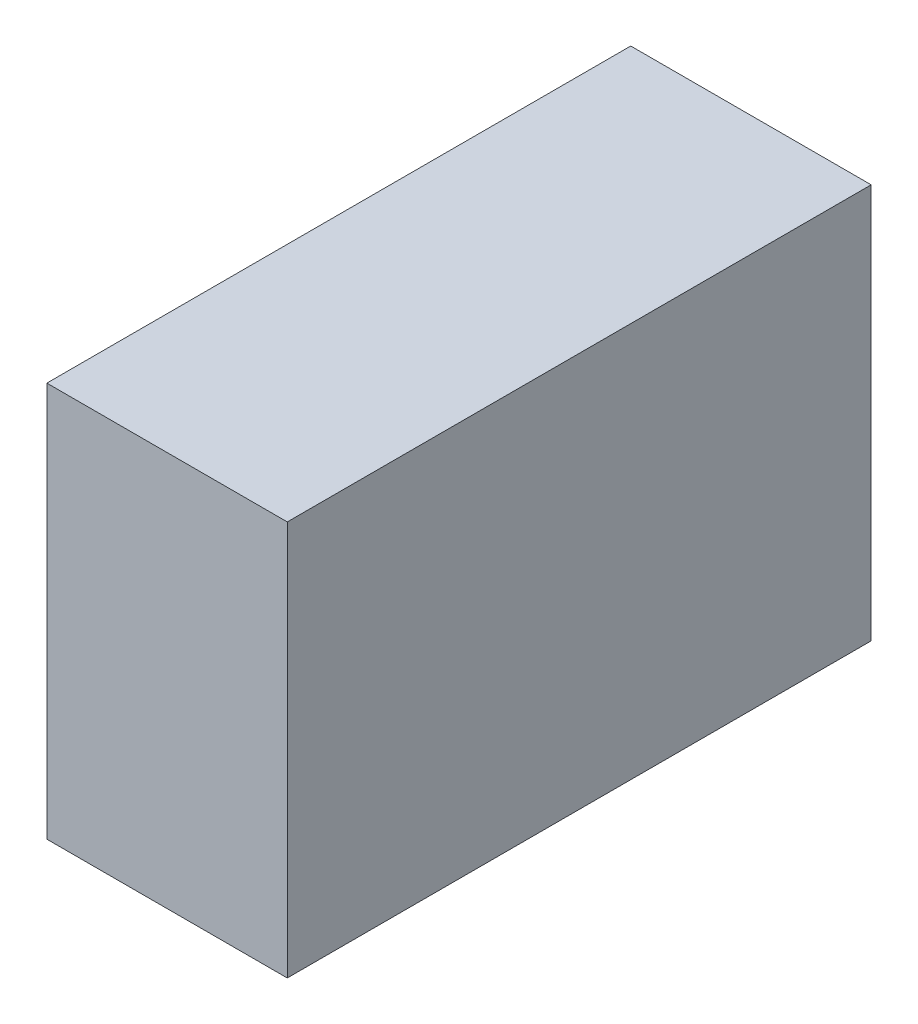
from build123d import *

# Parameters (mm, degrees)
SKETCH1_W           = 86.36
SKETCH1_H           = 58.42
BOSS_EXTRUDE1_DEPTH = 35.56


with BuildPart() as part:
    # Sketch1 → Boss-Extrude1 (new body)
    with BuildSketch(Plane(origin=(0, 0, 0), x_dir=(0, 0, -1), z_dir=(1, 0, 0))):
        with Locations((43.18, 29.21)):
            Rectangle(SKETCH1_W, SKETCH1_H)
    extrude(amount=BOSS_EXTRUDE1_DEPTH)


solid = part.part
